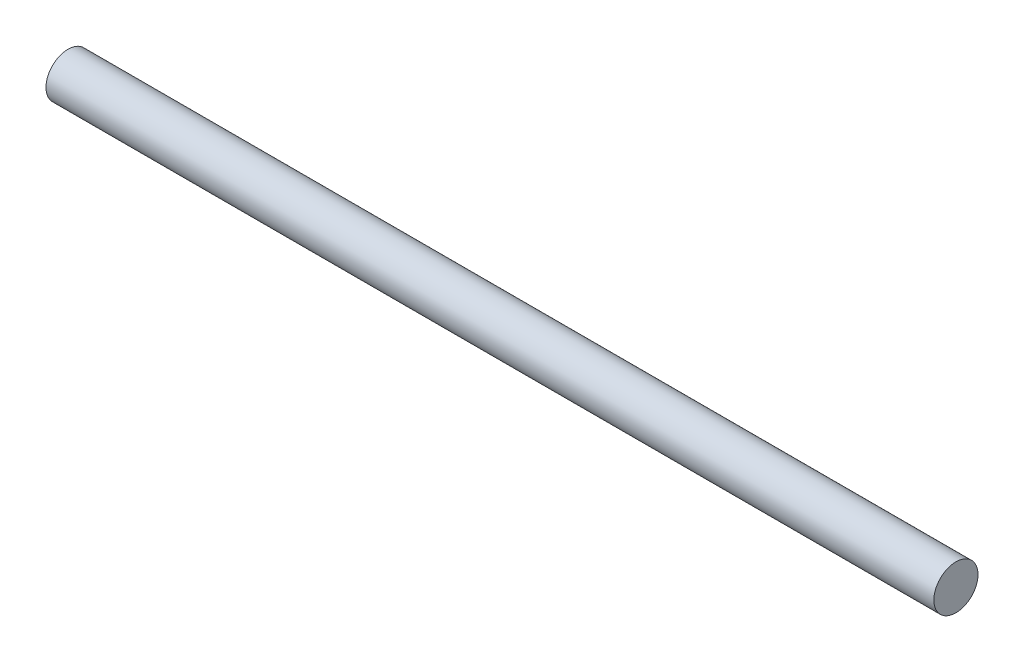
from build123d import *

# Parameters (mm, degrees)
SKETCH3_R           = 1.5
BOSS_EXTRUDE1_DEPTH = 30.15


with BuildPart() as part:
    # Sketch3 → Boss-Extrude1 (new, symmetric)
    with BuildSketch(Plane(origin=(0, 0, 0), x_dir=(0, 0, -1), z_dir=(1, 0, 0))):
        Circle(SKETCH3_R)
    extrude(amount=BOSS_EXTRUDE1_DEPTH, both=True)


solid = part.part
